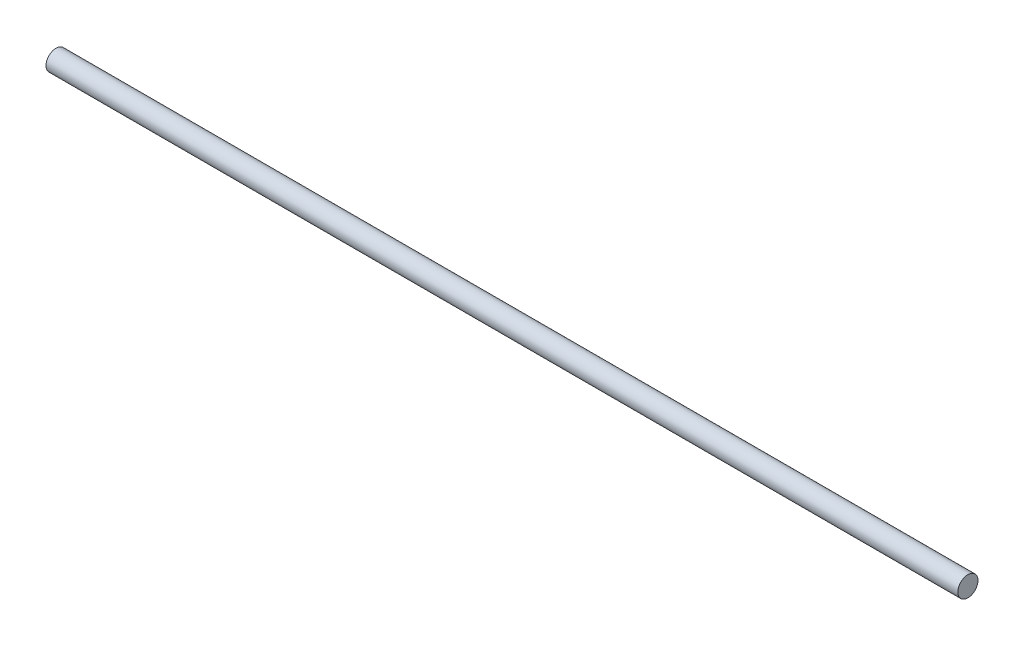
from build123d import *

# Parameters (mm, degrees)
ESBO_O1_R                = 4
RESSALTO_EXTRUS_O1_DEPTH = 181


with BuildPart() as part:
    # Esboço1 → Ressalto-extrusão1 (new, symmetric)
    with BuildSketch(Plane(origin=(0, 0, 0), x_dir=(0, 0, -1), z_dir=(1, 0, 0))):
        Circle(ESBO_O1_R)
    extrude(amount=RESSALTO_EXTRUS_O1_DEPTH, both=True)


solid = part.part
